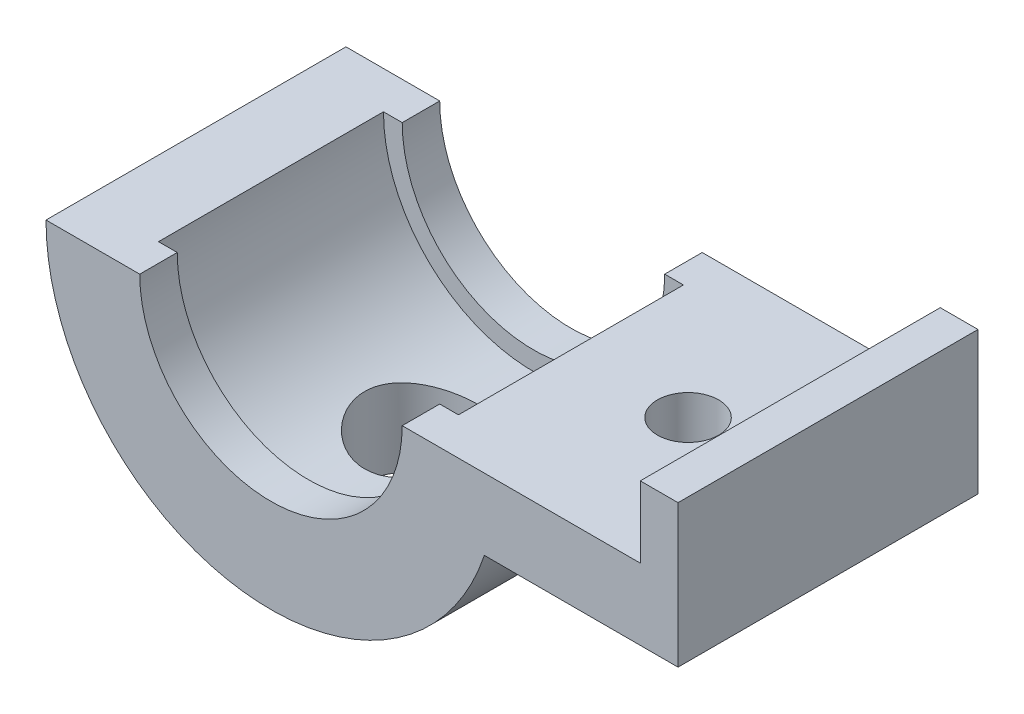
from build123d import *

# Parameters (mm, degrees)
EXTRUDE_1_DEPTH          = 40
EXTRUDE_1_DEPTH_BACK     = 40
CUT_EXTRUDE_1_DEPTH      = 30
CUT_EXTRUDE_1_DEPTH_BACK = 30
SKETCH_2_R               = 40
SKETCH_3_R               = 15
CUT_EXTRUDE_2_DEPTH      = 75
SKETCH_4_W               = 67.943944805
SKETCH_4_H               = 80
EXTRUDE_2_DEPTH          = 19
SKETCH_5_W               = 10.069063792
SKETCH_5_H               = 80
EXTRUDE_3_DEPTH          = 19
SKETCH_6_R               = 8.162997033
CUT_EXTRUDE_3_DEPTH      = 34


with BuildPart() as part:
    # 草图1 → 凸台-拉伸1 (new, two sides: drawn at the far end of the back side and taken through both)
    with BuildSketch(Plane.XY.offset(-EXTRUDE_1_DEPTH_BACK)):
        with BuildLine():
            Line((-60, 0), (-35, 0))
            ThreePointArc((-35, 0), (0, -35), (35, 0))
            Line((35, 0), (60, 0))
            ThreePointArc((60, 0), (0, -60), (-60, 0))
        make_face()
    extrude(amount=EXTRUDE_1_DEPTH + EXTRUDE_1_DEPTH_BACK)

    # 草图2 → 切除-拉伸1 (cut, two sides: drawn at the far end of the back side and taken through both)
    with BuildSketch(Plane.XY.offset(-CUT_EXTRUDE_1_DEPTH_BACK)):
        Circle(SKETCH_2_R)
    extrude(amount=CUT_EXTRUDE_1_DEPTH + CUT_EXTRUDE_1_DEPTH_BACK, mode=Mode.SUBTRACT)

    # 草图3 → 切除-拉伸2 (cut)
    with BuildSketch(Plane(origin=(0, 0, 0), x_dir=(1, 0, 0), z_dir=(0, 1, 0))):
        Circle(SKETCH_3_R)
    extrude(amount=-CUT_EXTRUDE_2_DEPTH, mode=Mode.SUBTRACT)

    # 草图4 → 凸台-拉伸2 (add)
    with BuildSketch(Plane(origin=(0, 0, 0), x_dir=(1, 0, 0), z_dir=(0, 1, 0))):
        with Locations((74.586023034, 0)):
            Rectangle(SKETCH_4_W, SKETCH_4_H)
    extrude(amount=-EXTRUDE_2_DEPTH)

    # 草图5 → 凸台-拉伸3 (add)
    with BuildSketch(Plane(origin=(0, 0, 0), x_dir=(1, 0, 0), z_dir=(0, 1, 0))):
        with Locations((103.52346354, 0)):
            Rectangle(SKETCH_5_W, SKETCH_5_H)
    extrude(amount=EXTRUDE_3_DEPTH)

    # 草图6 → 切除-拉伸3 (cut)
    with BuildSketch(Plane(origin=(0, 0, 0), x_dir=(1, 0, 0), z_dir=(0, 1, 0))):
        with Locations((71.232555132, 0)):
            Circle(SKETCH_6_R)
    extrude(amount=-CUT_EXTRUDE_3_DEPTH, mode=Mode.SUBTRACT)


solid = part.part
